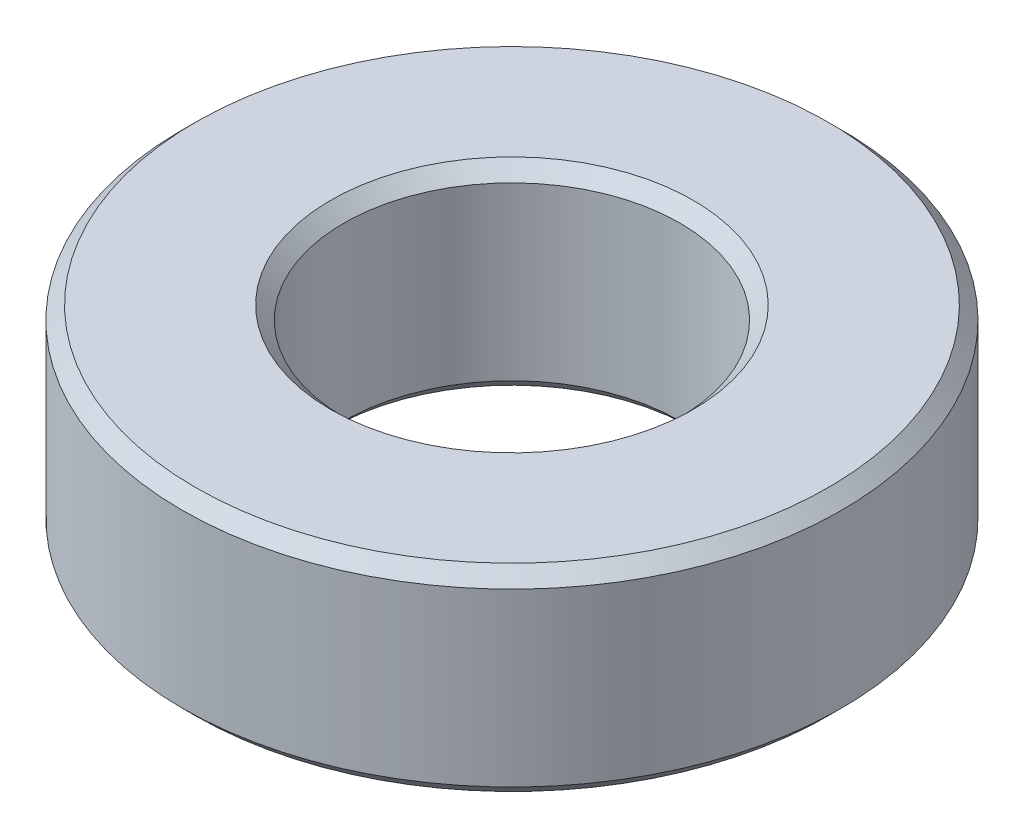
from build123d import *


with BuildPart() as part:
    # Sketch1 → Revolve1 (revolve)
    with BuildSketch(Plane(origin=(0, 0, 0), x_dir=(0, 0, -1), z_dir=(1, 0, 0)), mode=Mode.PRIVATE) as revolve1_sk:
        Polygon((2.55, 1.3), (2.75, 1.5), (4.8, 1.5), (5, 1.3), (5, -1.3), (4.8, -1.5), (2.75, -1.5), (2.55, -1.3), align=None)
    revolve(revolve1_sk.sketch.rotate(Axis((0, 2.133870968, 0), (0, -1, 0)), 180), axis=Axis((0, 2.133870968, 0), (0, -1, 0)))


solid = part.part
